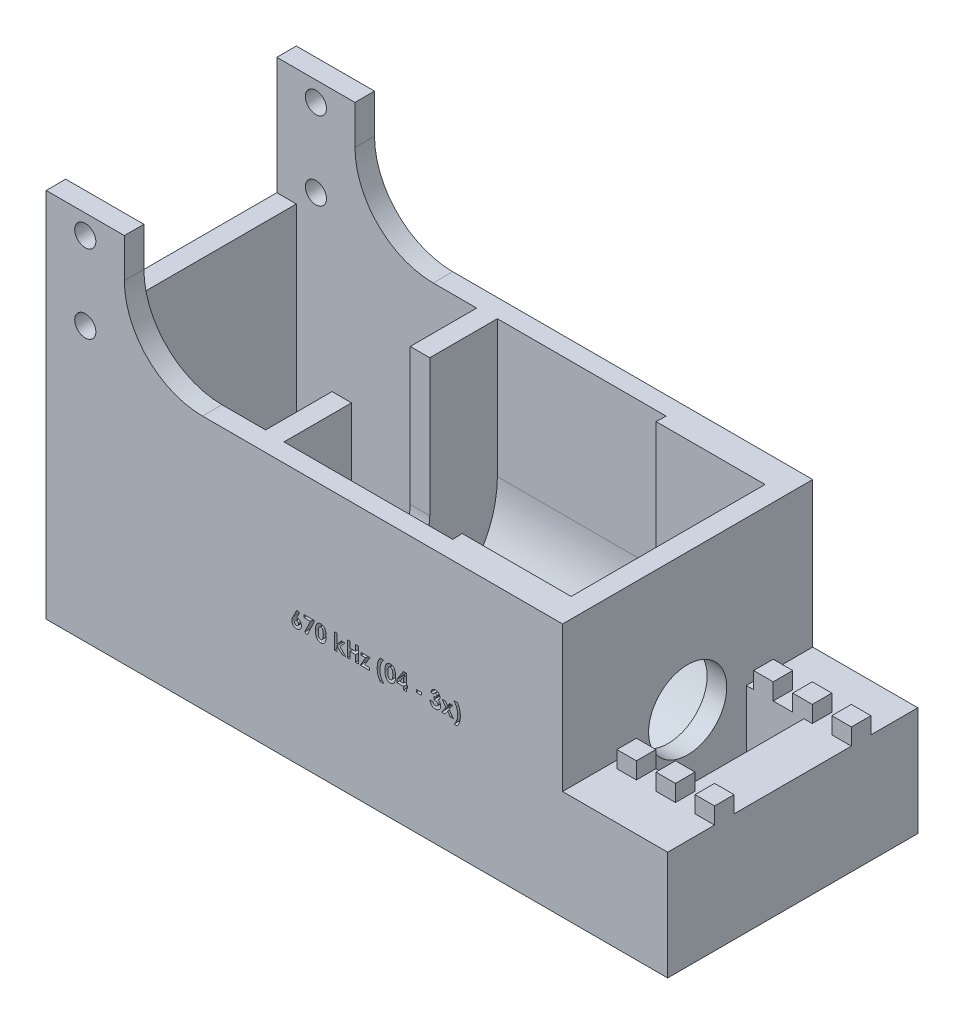
from build123d import *

# Parameters (mm, degrees)
SKETCH1_W                = 157.48
SKETCH1_H                = 76.2
BOSS_EXTRUDE1_DEPTH      = 40.64
SKETCH37_W               = 81.28
SKETCH37_H               = 38.1
CUT_EXTRUDE32_DEPTH      = 180.605122421
BOSS_EXTRUDE5_DEPTH      = 44.45
CUT_EXTRUDE54_DEPTH      = 119.593794104
CUT_EXTRUDE54_DEPTH_BACK = 119.593794104
SKETCH45_W               = 34.146518669
SKETCH45_H               = 47.14875
SKETCH97_W               = 20.4891
SKETCH97_H               = 81.28
CUT_EXTRUDE72_DEPTH      = 76.2
SKETCH99_W               = 27.796518669
SKETCH99_H               = 38.1
CUT_EXTRUDE74_DEPTH      = 123.770316038
SKETCH101_W              = 6.35
SKETCH101_H              = 6.35
BOSS_EXTRUDE7_DEPTH      = 5.3975
BOSS_EXTRUDE8_REACH      = 124.77
SKETCH102_W              = 20.4891
SKETCH102_H              = 6.35
SKETCH104_W              = 1.758461539
SKETCH104_H              = 0.846666666
CUT_EXTRUDE76_DEPTH      = 2.54
BOSS_EXTRUDE9_REACH      = 124.77
SKETCH105_W              = 6.35
SKETCH105_H              = 81.28
CUT_EXTRUDE77_REACH      = 147.407
SKETCH106_R              = 12.7
BOSS_EXTRUDE10_DEPTH     = 38.1
SKETCH108_W              = 81.28
SKETCH108_H              = 82.55
BOSS_EXTRUDE11_DEPTH     = 6.35
SKETCH109_W              = 9.05002
SKETCH109_H              = 38.1
BOSS_EXTRUDE12_DEPTH     = 35.40125
SKETCH110_W              = 25.4
SKETCH110_H              = 38.1
SKETCH110_R              = 3.429
BOSS_EXTRUDE13_DEPTH     = 6.35
FILLET1_R                = 25.4


with BuildPart() as part:
    # Sketch1 → Boss-Extrude1 (new, symmetric)
    with BuildSketch(Plane.XY):
        with Locations((2.54, -38.1)):
            Rectangle(SKETCH1_W, SKETCH1_H)
    extrude(amount=BOSS_EXTRUDE1_DEPTH, both=True)

    # Sketch2 → Cut-Revolve1 (revolve, cut)
    with BuildSketch(Plane.XY, mode=Mode.PRIVATE) as cut_revolve1_sk:
        Polygon((-49.3609, -3.429), (-49.3609, -25.4), (-76.2, -25.4), (-76.2, -38.1), (19.629439755, -38.1), (72.533481331, -38.1), (72.533481331, -28.194), (47.133481331, -28.194), (47.133481331, -6.600833492), (5.361335055, -6.600833492), (5.5031, -3.429), align=None)
    revolve(cut_revolve1_sk.sketch.rotate(Axis((-607.361866059, -38.1, 0), (1, 0, 0)), 90), axis=Axis((-607.361866059, -38.1, 0), (1, 0, 0)), mode=Mode.SUBTRACT)

    # Sketch37 → Cut-Extrude32 (cut, through all)
    with BuildSketch(Plane(origin=(81.28, 0, 0), x_dir=(0, 0, -1), z_dir=(1, 0, 0))):
        with Locations((0, -19.05)):
            Rectangle(SKETCH37_W, SKETCH37_H)
    extrude(amount=-CUT_EXTRUDE32_DEPTH, mode=Mode.SUBTRACT)

    # Sketch39 → Boss-Extrude5 (add)
    with BuildSketch(Plane(origin=(0, -38.1, 0), x_dir=(1, 0, 0), z_dir=(0, 1, 0))):
        Polygon((-49.3609, -12.7), (-76.2, -12.7), (-76.2, -40.64), (81.28, -40.64), (81.28, 40.64), (-76.2, 40.64), (-76.2, 12.7), (-49.3609, 12.7), (-49.3609, 34.671), (5.5031, 34.671), (5.361335055, 31.499166508), (47.133481331, 31.499166508), (47.133481331, 9.906), (72.533481331, 9.906), (72.533481331, -9.906), (47.133481331, -9.906), (47.133481331, -31.499166508), (5.361335055, -31.499166508), (5.5031, -34.671), (-49.3609, -34.671), align=None)
    extrude(amount=BOSS_EXTRUDE5_DEPTH)

    # Sketch45 → Cut-Extrude54 (cut, two sides: drawn at the far end of the back side and taken through both)
    with BuildSketch(Plane.XY.offset(-CUT_EXTRUDE54_DEPTH_BACK)):
        with Locations((64.206740666, -17.224375)):
            Rectangle(SKETCH45_W, SKETCH45_H)
    extrude(amount=CUT_EXTRUDE54_DEPTH + CUT_EXTRUDE54_DEPTH_BACK, mode=Mode.SUBTRACT)

    # Sketch97 → Cut-Extrude72 (cut)
    with BuildSketch(Plane(origin=(0, 6.35, 0), x_dir=(1, 0, 0), z_dir=(0, 1, 0))):
        with Locations((-65.95545, 0)):
            Rectangle(SKETCH97_W, SKETCH97_H)
    extrude(amount=-CUT_EXTRUDE72_DEPTH, mode=Mode.SUBTRACT)

    # Sketch99 → Cut-Extrude74 (cut, through all)
    with BuildSketch(Plane(origin=(0, 6.35, 0), x_dir=(1, 0, 0), z_dir=(0, 1, 0))):
        with Locations((61.031740666, 0)):
            Rectangle(SKETCH99_W, SKETCH99_H)
    extrude(amount=-CUT_EXTRUDE74_DEPTH, mode=Mode.SUBTRACT)

    # Sketch101 → Boss-Extrude7 (add)
    with BuildSketch(Plane(origin=(0, -40.79875, 0), x_dir=(1, 0, 0), z_dir=(0, 1, 0))):
        with Locations((52.705, 22.225)):
            Rectangle(SKETCH101_W, SKETCH101_H)
        with Locations((65.405, 22.225)):
            Rectangle(SKETCH101_W, SKETCH101_H)
        with Locations((78.105, 22.225)):
            Rectangle(SKETCH101_W, SKETCH101_H)
        with Locations((78.105, -22.225)):
            Rectangle(SKETCH101_W, SKETCH101_H)
        with Locations((65.405, -22.225)):
            Rectangle(SKETCH101_W, SKETCH101_H)
        with Locations((52.705, -22.225)):
            Rectangle(SKETCH101_W, SKETCH101_H)
    extrude(amount=BOSS_EXTRUDE7_DEPTH)

    # Sketch102 → Boss-Extrude8 (add, up to next)
    with BuildSketch(Plane(origin=(0, 6.35, 0), x_dir=(1, 0, 0), z_dir=(0, 1, 0)), mode=Mode.PRIVATE) as boss_extrude8_sk1:
        with Locations((-65.95545, 37.465)):
            Rectangle(SKETCH102_W, SKETCH102_H)
    boss_extrude8_tool1 = extrude(boss_extrude8_sk1.sketch, amount=-BOSS_EXTRUDE8_REACH, mode=Mode.PRIVATE) - part.part
    # Sketch102 → Boss-Extrude8 (add, up to next)
    with BuildSketch(Plane(origin=(0, 6.35, 0), x_dir=(1, 0, 0), z_dir=(0, 1, 0)), mode=Mode.PRIVATE) as boss_extrude8_sk2:
        with Locations((-65.95545, -37.465)):
            Rectangle(SKETCH102_W, SKETCH102_H)
    boss_extrude8_tool2 = extrude(boss_extrude8_sk2.sketch, amount=-BOSS_EXTRUDE8_REACH, mode=Mode.PRIVATE) - part.part
    add(boss_extrude8_tool1.solids().sort_by_distance((-65.95545, 6.35, -37.465))[0])
    add(boss_extrude8_tool2.solids().sort_by_distance((-65.95545, 6.35, 37.465))[0])

    # Sketch104 → Cut-Extrude76 (cut)
    # profile 1 of 13: a face of its own
    with BuildSketch(Plane.XY.offset(40.64)):
        with BuildLine():
            Line((-39.172073437, -32.88974359), (-38.36509427, -33.298830128))
            Line((-38.36509427, -33.298830128), (-39.250430809, -35.038974359))
            add(Edge.make_bspline(
                [(-39.250430809, -35.038974359), (-39.198125957, -35.040328558), (-39.095102973, -35.042995875), (-38.943525557, -35.064553577), (-38.798614726, -35.101821675), (-38.65890935, -35.151220437), (-38.526117195, -35.217563466), (-38.398099569, -35.29648196), (-38.278168354, -35.392731551), (-38.163573628, -35.499370993), (-38.059373233, -35.617512167), (-37.968856768, -35.744458613), (-37.889973267, -35.877121706), (-37.828652407, -36.018469442), (-37.77918896, -36.166158823), (-37.743498907, -36.320780225), (-37.723136732, -36.482781398), (-37.720329467, -36.592836133), (-37.71890036, -36.648862179)],
                knots=[0, 0, 0, 0, 1.013260694, 1.995783107, 2.958651975, 3.908806537, 4.861209129, 5.829647963, 6.817170299, 7.835534541, 8.860094905, 9.863329007, 10.853101798, 11.844815043, 12.84250023, 13.867713965, 14.914507806, 16, 16, 16, 16], degree=3))
            add(Edge.make_bspline(
                [(-37.71890036, -36.648862179), (-37.720239551, -36.70286789), (-37.722886559, -36.80961402), (-37.744767577, -36.966396937), (-37.780128452, -37.116820977), (-37.830666244, -37.260585725), (-37.894903864, -37.398393906), (-37.973462122, -37.530164654), (-38.066992507, -37.65491329), (-38.173078451, -37.771976958), (-38.289048689, -37.878681357), (-38.411287637, -37.973526437), (-38.540831132, -38.051872071), (-38.67523065, -38.118036796), (-38.816960568, -38.167410014), (-38.963899892, -38.204678241), (-39.117162904, -38.226183625), (-39.221193911, -38.228887952), (-39.273836258, -38.23025641)],
                knots=[0, 0, 0, 0, 1.049934834, 2.075270938, 3.072134561, 4.05064612, 5.033440221, 6.024524368, 7.028587226, 8.060776465, 9.092543989, 10.090062252, 11.064205434, 12.031961459, 12.998029633, 13.977230324, 14.976426867, 16, 16, 16, 16], degree=3))
            add(Edge.make_bspline(
                [(-39.273836258, -38.23025641), (-39.328884155, -38.229133389), (-39.437128397, -38.22692512), (-39.595516814, -38.202198327), (-39.747424937, -38.164975586), (-39.891999019, -38.111827837), (-40.030138122, -38.04415426), (-40.160215908, -37.960415015), (-40.283328102, -37.861533521), (-40.398162148, -37.749734457), (-40.501619065, -37.627273878), (-40.593893989, -37.500127914), (-40.671958693, -37.368097044), (-40.735150251, -37.231322435), (-40.784453771, -37.090239925), (-40.818758965, -36.944581751), (-40.841111964, -36.794734271), (-40.843732344, -36.693039292), (-40.845054206, -36.641738782)],
                knots=[0, 0, 0, 0, 1.063775006, 2.091769615, 3.092589432, 4.084662827, 5.064601646, 6.061867366, 7.070035304, 8.113879863, 9.156342271, 10.166834137, 11.149076039, 12.117706134, 13.076241869, 14.034148791, 15.008317125, 16, 16, 16, 16], degree=3))
            add(Edge.make_bspline(
                [(-40.845054206, -36.641738782), (-40.84435576, -36.602012538), (-40.84295498, -36.522338918), (-40.828877975, -36.403032002), (-40.807475982, -36.283411916), (-40.782668271, -36.1824727), (-40.757123796, -36.097118029), (-40.731413086, -36.024884678), (-40.699550326, -35.944721452), (-40.663126471, -35.856423648), (-40.620996125, -35.760097487), (-40.573379367, -35.65600553), (-40.520157654, -35.543359513), (-40.482203243, -35.465989143), (-40.462426001, -35.425673077)],
                knots=[0, 0, 0, 0, 1.110454016, 2.227089276, 3.35462975, 4.507227546, 5.131400587, 5.845402449, 6.650387134, 7.543487832, 8.516250726, 9.590168902, 10.744287919, 12, 12, 12, 12], degree=3))
            Line((-40.462426001, -35.425673077), (-39.172073437, -32.88974359))
        make_face()
        with BuildLine():
            add(Edge.make_bspline(
                [(-39.294188822, -35.885641026), (-39.337939515, -35.887647777), (-39.423553878, -35.891574727), (-39.545284699, -35.932699659), (-39.656275589, -35.997214441), (-39.752483865, -36.087063752), (-39.832953235, -36.194437207), (-39.892084952, -36.316910975), (-39.927655966, -36.452850676), (-39.931351566, -36.547897449), (-39.933259334, -36.596963141)],
                knots=[0, 0, 0, 0, 0.981744412, 1.921144944, 2.858899012, 3.85339082, 4.86292663, 5.863643845, 6.897155691, 8, 8, 8, 8], degree=3))
            add(Edge.make_bspline(
                [(-39.933259334, -36.596963141), (-39.931000477, -36.646045172), (-39.926606849, -36.741513003), (-39.889698319, -36.878747093), (-39.829267602, -37.004002097), (-39.744517375, -37.112798484), (-39.645021827, -37.203107908), (-39.534693065, -37.269896045), (-39.415371413, -37.31092619), (-39.332833712, -37.315932412), (-39.291135937, -37.318461538)],
                knots=[0, 0, 0, 0, 1.098279937, 2.136227893, 3.159405121, 4.194678092, 5.206500211, 6.154139736, 7.067477469, 8, 8, 8, 8], degree=3))
            add(Edge.make_bspline(
                [(-39.291135937, -37.318461538), (-39.247098374, -37.315887366), (-39.160733064, -37.310838967), (-39.03614544, -37.271535296), (-38.922333898, -37.205866079), (-38.82170248, -37.115845788), (-38.735262004, -37.008290915), (-38.675453926, -36.88230018), (-38.636839098, -36.744075583), (-38.632789104, -36.647100081), (-38.630695232, -36.596963141)],
                knots=[0, 0, 0, 0, 0.96921794, 1.900804717, 2.848419905, 3.844199796, 4.861108892, 5.867439427, 6.897452859, 8, 8, 8, 8], degree=3))
            add(Edge.make_bspline(
                [(-38.630695232, -36.596963141), (-38.633080535, -36.547926098), (-38.637699953, -36.452960139), (-38.672397253, -36.316383591), (-38.734346941, -36.194381883), (-38.816636996, -36.086620532), (-38.91615625, -35.996811285), (-39.031589221, -35.932190875), (-39.158880909, -35.891647587), (-39.248428585, -35.887672405), (-39.294188822, -35.885641026)],
                knots=[0, 0, 0, 0, 1.083229974, 2.097801324, 3.086792542, 4.086858909, 5.079819718, 6.026392613, 6.991456328, 8, 8, 8, 8], degree=3))
        make_face(mode=Mode.SUBTRACT)
    # profile 2 of 13: a face of its own
    with BuildSketch(Plane.XY.offset(40.64)):
        Polygon((-36.872233693, -33.02), (-33.615823437, -33.02), (-33.615823437, -33.493197115), (-35.856640745, -38.23025641), (-36.66463754, -37.823205128), (-34.792201642, -33.866666667), (-36.872233693, -33.866666667), align=None)
    # profile 3 of 13: a face of its own
    with BuildSketch(Plane.XY.offset(40.64)):
        with BuildLine():
            add(Edge.make_bspline(
                [(-31.449292988, -32.88974359), (-31.405158332, -32.890398781), (-31.318377806, -32.891687063), (-31.190566426, -32.905640199), (-31.06744873, -32.926719497), (-30.948543066, -32.956117767), (-30.834705328, -32.995025331), (-30.725106982, -33.041597017), (-30.621052566, -33.098275607), (-30.521215054, -33.162296986), (-30.425632902, -33.234778263), (-30.336603361, -33.31741066), (-30.252500563, -33.408292804), (-30.175145023, -33.50879867), (-30.102823679, -33.618014049), (-30.035774167, -33.73595626), (-29.974509768, -33.86320255), (-29.918343854, -33.999982547), (-29.868120117, -34.148346524), (-29.825816725, -34.309996278), (-29.789534487, -34.484968726), (-29.758909719, -34.673699402), (-29.735762344, -34.876439172), (-29.720160547, -35.093053346), (-29.709453856, -35.323124326), (-29.70858005, -35.480951127), (-29.708131129, -35.562035256)],
                knots=[0, 0, 0, 0, 0.879237366, 1.728815576, 2.559023295, 3.367336655, 4.166867292, 4.954216142, 5.737608147, 6.525189134, 7.316157332, 8.124696809, 8.942788509, 9.781158001, 10.649253743, 11.551476218, 12.482711956, 13.461909668, 14.496590415, 15.601789533, 16.789733467, 18.056700938, 19.410929216, 20.8549011, 22.384193279, 24, 24, 24, 24], degree=3))
            add(Edge.make_bspline(
                [(-29.708131129, -35.562035256), (-29.708616292, -35.64413384), (-29.709558953, -35.803649914), (-29.719715467, -36.035825239), (-29.737205464, -36.254012163), (-29.759747833, -36.458188112), (-29.790624714, -36.648245265), (-29.826785833, -36.824675741), (-29.869756972, -36.987415589), (-29.921635063, -37.136098122), (-29.977461003, -37.273118334), (-30.038892987, -37.400116525), (-30.104860262, -37.517436676), (-30.17384974, -37.626848721), (-30.249643675, -37.725127247), (-30.328552965, -37.81561424), (-30.414013461, -37.894862933), (-30.502426944, -37.966957449), (-30.59703236, -38.029261578), (-30.696854066, -38.083751742), (-30.803671711, -38.127949738), (-30.91553819, -38.166390793), (-31.034360292, -38.193987323), (-31.158249947, -38.215884263), (-31.288605847, -38.227985855), (-31.377357394, -38.229487137), (-31.422834655, -38.23025641)],
                knots=[0, 0, 0, 0, 1.643780988, 3.193836972, 4.651895693, 6.025988579, 7.305620092, 8.505800249, 9.631074763, 10.672816429, 11.65661981, 12.592235626, 13.49536222, 14.350718032, 15.179365177, 15.97804903, 16.751647189, 17.51006938, 18.259804725, 19.016521909, 19.783502495, 20.571750527, 21.382245291, 22.22305063, 23.089471752, 24, 24, 24, 24], degree=3))
            add(Edge.make_bspline(
                [(-31.422834655, -38.23025641), (-31.468310689, -38.229472298), (-31.55739757, -38.227936234), (-31.688105965, -38.215974243), (-31.812652173, -38.193898618), (-31.932414348, -38.166178927), (-32.046558963, -38.128034792), (-32.155633339, -38.082514425), (-32.258798787, -38.028364252), (-32.356340957, -37.96591496), (-32.447926812, -37.894302811), (-32.534979596, -37.814293778), (-32.617306742, -37.726090663), (-32.693655851, -37.628705518), (-32.7652773, -37.523438232), (-32.831424191, -37.409086703), (-32.892056771, -37.285817425), (-32.949071639, -37.153458573), (-32.998610342, -37.009160612), (-33.042697488, -36.851634981), (-33.078812518, -36.679568573), (-33.107858641, -36.493016666), (-33.13104905, -36.292374478), (-33.148300048, -36.077545166), (-33.158512977, -35.848428667), (-33.159445753, -35.690945484), (-33.159926001, -35.609863782)],
                knots=[0, 0, 0, 0, 0.917216111, 1.796812873, 2.643793957, 3.46689424, 4.273913431, 5.068098542, 5.848489301, 6.620921603, 7.401012384, 8.190319798, 9.003608147, 9.831726257, 10.68377682, 11.569763213, 12.493818149, 13.453288342, 14.474581811, 15.568529029, 16.750744269, 18.018426408, 19.375425659, 20.823733699, 22.36466933, 24, 24, 24, 24], degree=3))
            add(Edge.make_bspline(
                [(-33.159926001, -35.609863782), (-33.159056076, -35.49720714), (-33.157377544, -35.279834698), (-33.136105958, -34.965794719), (-33.104884665, -34.675519159), (-33.059027981, -34.409493576), (-33.002326825, -34.16673269), (-32.929718043, -33.948835682), (-32.847058226, -33.752787457), (-32.776621442, -33.636647309), (-32.742698437, -33.580713141)],
                knots=[0, 0, 0, 0, 1.288568992, 2.486310467, 3.599230591, 4.627010532, 5.572937695, 6.447898582, 7.252493626, 8, 8, 8, 8], degree=3))
            add(Edge.make_bspline(
                [(-32.742698437, -33.580713141), (-32.703254382, -33.525763432), (-32.626133483, -33.418325923), (-32.491285435, -33.277280557), (-32.346408764, -33.156651653), (-32.188527786, -33.059169151), (-32.020139455, -32.982294442), (-31.839798071, -32.927998702), (-31.648169605, -32.896363473), (-31.516575141, -32.891983169), (-31.449292988, -32.88974359)],
                knots=[0, 0, 0, 0, 1.058512271, 2.069600068, 3.047294572, 4.004278952, 4.967380941, 5.939006123, 6.946246673, 8, 8, 8, 8], degree=3))
        make_face()
        with BuildLine():
            add(Edge.make_bspline(
                [(-31.426905168, -33.801538462), (-31.466803263, -33.803429552), (-31.545024709, -33.807137093), (-31.658527753, -33.838608885), (-31.765554038, -33.887218766), (-31.846966074, -33.945713156), (-31.907902173, -34.001787044), (-31.950478663, -34.05253209), (-31.991536976, -34.109159903), (-32.027801746, -34.174225806), (-32.062045156, -34.245391905), (-32.095511289, -34.32298125), (-32.12294473, -34.408899604), (-32.149897359, -34.501683767), (-32.173510376, -34.603898973), (-32.193292908, -34.71638072), (-32.210966862, -34.839860486), (-32.223294655, -34.974419151), (-32.234787858, -35.119915934), (-32.243026731, -35.276674944), (-32.246471196, -35.444653892), (-32.247566087, -35.560338501), (-32.248131129, -35.620040064)],
                knots=[0, 0, 0, 0, 1.076674018, 2.110852608, 3.161083442, 4.239746716, 4.804137807, 5.395870207, 6.026861976, 6.692161227, 7.405688833, 8.16177676, 8.973626916, 9.841385931, 10.773283133, 11.807421078, 12.927755683, 14.143907515, 15.458935494, 16.872852025, 18.386167141, 20, 20, 20, 20], degree=3))
            add(Edge.make_bspline(
                [(-32.248131129, -35.620040064), (-32.247201138, -35.697386325), (-32.245417812, -35.845703516), (-32.23607758, -36.058988801), (-32.21735586, -36.253095584), (-32.194069821, -36.4293394), (-32.161363628, -36.586577259), (-32.123733035, -36.726296778), (-32.0772626, -36.846716872), (-32.023557058, -36.949579087), (-31.96407575, -37.03708376), (-31.899506174, -37.111463125), (-31.832046692, -37.175872147), (-31.759591674, -37.228190802), (-31.682313977, -37.268285407), (-31.600858728, -37.297124961), (-31.515174161, -37.314778853), (-31.456498254, -37.31722688), (-31.426905168, -37.318461538)],
                knots=[0, 0, 0, 0, 1.771748488, 3.397459088, 4.888034009, 6.237357457, 7.467047327, 8.564189669, 9.548206622, 10.417051504, 11.216568818, 11.965764335, 12.669334354, 13.348544111, 14.005342236, 14.656555988, 15.322436492, 16, 16, 16, 16], degree=3))
            add(Edge.make_bspline(
                [(-31.426905168, -37.318461538), (-31.398327623, -37.317616694), (-31.342376343, -37.315962593), (-31.260786847, -37.298983468), (-31.183630022, -37.271379099), (-31.111138829, -37.232330782), (-31.043053976, -37.182674872), (-30.979708221, -37.122193159), (-30.921579304, -37.050282783), (-30.887713134, -36.996914649), (-30.87026254, -36.969415064)],
                knots=[0, 0, 0, 0, 0.992283464, 1.942767638, 2.88273346, 3.832339453, 4.79467288, 5.803907806, 6.868395428, 8, 8, 8, 8], degree=3))
            add(Edge.make_bspline(
                [(-30.87026254, -36.969415064), (-30.849717404, -36.93183776), (-30.806635921, -36.8530412), (-30.756781954, -36.720074943), (-30.714817663, -36.570110982), (-30.678699612, -36.402682614), (-30.653997068, -36.217129481), (-30.632723268, -36.014628192), (-30.622462385, -35.794159032), (-30.620793396, -35.641417203), (-30.619926001, -35.562035256)],
                knots=[0, 0, 0, 0, 0.710965849, 1.490837728, 2.352621235, 3.297892224, 4.334225155, 5.461620853, 6.680770821, 8, 8, 8, 8], degree=3))
            add(Edge.make_bspline(
                [(-30.619926001, -35.562035256), (-30.620261057, -35.481964236), (-30.620905983, -35.327841191), (-30.632738503, -35.106579429), (-30.649216192, -34.904493531), (-30.673318293, -34.722034673), (-30.704330028, -34.558759924), (-30.742552107, -34.414679958), (-30.787613096, -34.289510821), (-30.841050058, -34.183377324), (-30.900234814, -34.093178411), (-30.96306124, -34.01579474), (-31.02979499, -33.949726514), (-31.100324464, -33.894725106), (-31.176282093, -33.852699906), (-31.256216985, -33.823026638), (-31.340293014, -33.805075306), (-31.397644768, -33.802733322), (-31.426905168, -33.801538462)],
                knots=[0, 0, 0, 0, 1.793836731, 3.452829483, 4.963243077, 6.335886805, 7.574563692, 8.684454726, 9.672768357, 10.54971625, 11.340229787, 12.085688095, 12.778991901, 13.440269426, 14.083255152, 14.715733572, 15.344777694, 16, 16, 16, 16], degree=3))
        make_face(mode=Mode.SUBTRACT)
    # profile 4 of 13: a face of its own
    with BuildSketch(Plane.XY.offset(40.64)):
        Polygon((-27.037874719, -32.88974359), (-26.126079847, -32.88974359), (-26.126079847, -35.92838141), (-24.707506129, -34.387692308), (-23.580991706, -34.387692308), (-25.210214463, -36.157347756), (-23.347954847, -38.1), (-24.495839463, -38.1), (-26.126079847, -36.399543269), (-26.126079847, -38.1), (-27.037874719, -38.1), align=None)
    # profile 5 of 13: a face of its own
    with BuildSketch(Plane.XY.offset(40.64)):
        Polygon((-22.804541386, -33.02), (-21.892746514, -33.02), (-21.892746514, -34.973846154), (-20.134284975, -34.973846154), (-20.134284975, -33.02), (-19.222490104, -33.02), (-19.222490104, -38.1), (-20.134284975, -38.1), (-20.134284975, -35.885641026), (-21.892746514, -35.885641026), (-21.892746514, -38.1), (-22.804541386, -38.1), align=None)
    # profile 6 of 13: a face of its own
    with BuildSketch(Plane.XY.offset(40.64)):
        Polygon((-18.310695232, -34.387692308), (-15.445054206, -34.387692308), (-17.152634334, -37.318461538), (-15.575310616, -37.318461538), (-15.575310616, -38.1), (-18.571208052, -38.1), (-16.863627924, -35.169230769), (-18.310695232, -35.169230769), align=None)
    # profile 7 of 13: a face of its own
    with BuildSketch(Plane.XY.offset(40.64)):
        with BuildLine():
            Line((-12.155062219, -32.88974359), (-11.016336258, -32.88974359))
            add(Edge.make_bspline(
                [(-11.016336258, -32.88974359), (-11.064763976, -32.945901653), (-11.16092096, -33.057407833), (-11.293606764, -33.232148184), (-11.418396295, -33.409331897), (-11.533505033, -33.590688771), (-11.639150224, -33.775907622), (-11.73620406, -33.964068959), (-11.822793818, -34.156116037), (-11.900430083, -34.351979385), (-11.968966932, -34.553295504), (-12.027931989, -34.761191002), (-12.077607759, -34.97586635), (-12.118457008, -35.197578165), (-12.149833266, -35.426126606), (-12.171707103, -35.662116454), (-12.186928062, -35.904776108), (-12.188067578, -36.069129226), (-12.18864395, -36.152259615)],
                knots=[0, 0, 0, 0, 1.00236213, 1.990267575, 2.964862165, 3.931797803, 4.893137898, 5.846900052, 6.793123604, 7.740135921, 8.694427184, 9.667077551, 10.660503013, 11.672460941, 12.714089686, 13.778281025, 14.87624668, 16, 16, 16, 16], degree=3))
            add(Edge.make_bspline(
                [(-12.18864395, -36.152259615), (-12.187686258, -36.242170849), (-12.18579837, -36.419411868), (-12.170275765, -36.681187515), (-12.144601459, -36.934703768), (-12.110880266, -37.180444682), (-12.064522703, -37.417268598), (-12.009948628, -37.646424364), (-11.944211717, -37.86689538), (-11.891883373, -38.009340947), (-11.866055809, -38.079647436)],
                knots=[0, 0, 0, 0, 1.097990858, 2.164457195, 3.201156713, 4.209415668, 5.192484095, 6.147015238, 7.085427113, 8, 8, 8, 8], degree=3))
            add(Edge.make_bspline(
                [(-11.866055809, -38.079647436), (-11.843904352, -38.13383593), (-11.798669361, -38.244493031), (-11.718202878, -38.409424987), (-11.628133908, -38.577938975), (-11.526076126, -38.749277676), (-11.41633677, -38.925658505), (-11.291859447, -39.103205095), (-11.159222316, -39.285607619), (-11.06455224, -39.406248999), (-11.016336258, -39.467692308)],
                knots=[0, 0, 0, 0, 0.860028042, 1.756243877, 2.695094802, 3.667075869, 4.686284936, 5.746781471, 6.852423585, 8, 8, 8, 8], degree=3))
            Line((-11.016336258, -39.467692308), (-12.155062219, -39.467692308))
            add(Edge.make_bspline(
                [(-12.155062219, -39.467692308), (-12.197990499, -39.397443944), (-12.282258774, -39.259546303), (-12.397725175, -39.050622607), (-12.506339563, -38.847227061), (-12.602662152, -38.645778288), (-12.691202392, -38.448929197), (-12.766422771, -38.253914829), (-12.835976509, -38.063976685), (-12.893266715, -37.874218158), (-12.942207734, -37.68226533), (-12.985506698, -37.484182202), (-13.020413358, -37.277603308), (-13.050296301, -37.062851037), (-13.07220815, -36.839772414), (-13.088338209, -36.608681843), (-13.099031059, -36.369454361), (-13.099964489, -36.20722322), (-13.100438822, -36.124783654)],
                knots=[0, 0, 0, 0, 1.119871376, 2.19830916, 3.246961562, 4.256259542, 5.235550337, 6.182491613, 7.09917337, 7.986748165, 8.877687696, 9.793695483, 10.744317876, 11.727190303, 12.742913882, 13.793068013, 14.878522868, 16, 16, 16, 16], degree=3))
            add(Edge.make_bspline(
                [(-13.100438822, -36.124783654), (-13.100051619, -36.044036694), (-13.099288207, -35.88483511), (-13.087305396, -35.650022563), (-13.070069912, -35.422680048), (-13.047559151, -35.202878624), (-13.015220688, -34.9909313), (-12.978254585, -34.786395131), (-12.933289716, -34.589498086), (-12.881138625, -34.398638217), (-12.820419663, -34.211432073), (-12.752181999, -34.024601806), (-12.674703115, -33.837229878), (-12.587861219, -33.649140064), (-12.493287696, -33.459524186), (-12.38953926, -33.269374824), (-12.276326602, -33.078939225), (-12.195790875, -32.953288085), (-12.155062219, -32.88974359)],
                knots=[0, 0, 0, 0, 1.13127193, 2.230428031, 3.293392423, 4.325815098, 5.325330466, 6.296707414, 7.23754678, 8.15420938, 9.068070667, 9.994306547, 10.940496973, 11.908145907, 12.896524899, 13.908929949, 14.942500703, 16, 16, 16, 16], degree=3))
        make_face()
    # profile 8 of 13: a face of its own
    with BuildSketch(Plane.XY.offset(40.64)):
        with BuildLine():
            add(Edge.make_bspline(
                [(-8.849805809, -32.88974359), (-8.805671153, -32.890398781), (-8.718890627, -32.891687063), (-8.591079247, -32.905640199), (-8.467961551, -32.926719497), (-8.349055886, -32.956117767), (-8.235218148, -32.995025331), (-8.125619803, -33.041597017), (-8.021565387, -33.098275607), (-7.921727874, -33.162296986), (-7.826145722, -33.234778263), (-7.737116181, -33.31741066), (-7.653013383, -33.408292804), (-7.575657843, -33.50879867), (-7.503336499, -33.618014049), (-7.436286988, -33.73595626), (-7.375022589, -33.86320255), (-7.318856675, -33.999982547), (-7.268632937, -34.148346524), (-7.226329545, -34.309996278), (-7.190047308, -34.484968726), (-7.15942254, -34.673699402), (-7.136275164, -34.876439172), (-7.120673368, -35.093053346), (-7.109966676, -35.323124326), (-7.109092871, -35.480951127), (-7.10864395, -35.562035256)],
                knots=[0, 0, 0, 0, 0.879237366, 1.728815576, 2.559023295, 3.367336655, 4.166867292, 4.954216142, 5.737608147, 6.525189134, 7.316157332, 8.124696809, 8.942788509, 9.781158001, 10.649253743, 11.551476218, 12.482711956, 13.461909668, 14.496590415, 15.601789533, 16.789733467, 18.056700938, 19.410929216, 20.8549011, 22.384193279, 24, 24, 24, 24], degree=3))
            add(Edge.make_bspline(
                [(-7.10864395, -35.562035256), (-7.109129112, -35.64413384), (-7.110071774, -35.803649914), (-7.120228287, -36.035825239), (-7.137718284, -36.254012163), (-7.160260654, -36.458188112), (-7.191137535, -36.648245265), (-7.227298654, -36.824675741), (-7.270269792, -36.987415589), (-7.322147884, -37.136098122), (-7.377973824, -37.273118334), (-7.439405807, -37.400116525), (-7.505373083, -37.517436676), (-7.57436256, -37.626848721), (-7.650156496, -37.725127247), (-7.729065786, -37.81561424), (-7.814526281, -37.894862933), (-7.902939765, -37.966957449), (-7.99754518, -38.029261578), (-8.097366886, -38.083751742), (-8.204184531, -38.127949738), (-8.316051011, -38.166390793), (-8.434873112, -38.193987323), (-8.558762768, -38.215884263), (-8.689118667, -38.227985855), (-8.777870214, -38.229487137), (-8.823347475, -38.23025641)],
                knots=[0, 0, 0, 0, 1.643780988, 3.193836972, 4.651895693, 6.025988579, 7.305620092, 8.505800249, 9.631074763, 10.672816429, 11.65661981, 12.592235626, 13.49536222, 14.350718032, 15.179365177, 15.97804903, 16.751647189, 17.51006938, 18.259804725, 19.016521909, 19.783502495, 20.571750527, 21.382245291, 22.22305063, 23.089471752, 24, 24, 24, 24], degree=3))
            add(Edge.make_bspline(
                [(-8.823347475, -38.23025641), (-8.868823509, -38.229472298), (-8.95791039, -38.227936234), (-9.088618785, -38.215974243), (-9.213164994, -38.193898618), (-9.332927169, -38.166178927), (-9.447071784, -38.128034792), (-9.556146159, -38.082514425), (-9.659311608, -38.028364252), (-9.756853778, -37.96591496), (-9.848439633, -37.894302811), (-9.935492416, -37.814293778), (-10.017819563, -37.726090663), (-10.094168672, -37.628705518), (-10.165790121, -37.523438232), (-10.231937012, -37.409086703), (-10.292569592, -37.285817425), (-10.34958446, -37.153458573), (-10.399123163, -37.009160612), (-10.443210308, -36.851634981), (-10.479325338, -36.679568573), (-10.508371462, -36.493016666), (-10.53156187, -36.292374478), (-10.548812869, -36.077545166), (-10.559025797, -35.848428667), (-10.559958573, -35.690945484), (-10.560438822, -35.609863782)],
                knots=[0, 0, 0, 0, 0.917216111, 1.796812873, 2.643793957, 3.46689424, 4.273913431, 5.068098542, 5.848489301, 6.620921603, 7.401012384, 8.190319798, 9.003608147, 9.831726257, 10.68377682, 11.569763213, 12.493818149, 13.453288342, 14.474581811, 15.568529029, 16.750744269, 18.018426408, 19.375425659, 20.823733699, 22.36466933, 24, 24, 24, 24], degree=3))
            add(Edge.make_bspline(
                [(-10.560438822, -35.609863782), (-10.559568897, -35.49720714), (-10.557890365, -35.279834698), (-10.536618779, -34.965794719), (-10.505397485, -34.675519159), (-10.459540801, -34.409493576), (-10.402839646, -34.16673269), (-10.330230863, -33.948835682), (-10.247571046, -33.752787457), (-10.177134263, -33.636647309), (-10.143211258, -33.580713141)],
                knots=[0, 0, 0, 0, 1.288568992, 2.486310467, 3.599230591, 4.627010532, 5.572937695, 6.447898582, 7.252493626, 8, 8, 8, 8], degree=3))
            add(Edge.make_bspline(
                [(-10.143211258, -33.580713141), (-10.103767203, -33.525763432), (-10.026646303, -33.418325923), (-9.891798255, -33.277280557), (-9.746921585, -33.156651653), (-9.589040607, -33.059169151), (-9.420652276, -32.982294442), (-9.240310892, -32.927998702), (-9.048682426, -32.896363473), (-8.917087961, -32.891983169), (-8.849805809, -32.88974359)],
                knots=[0, 0, 0, 0, 1.058512271, 2.069600068, 3.047294572, 4.004278952, 4.967380941, 5.939006123, 6.946246673, 8, 8, 8, 8], degree=3))
        make_face()
        with BuildLine():
            add(Edge.make_bspline(
                [(-8.827417988, -33.801538462), (-8.867316083, -33.803429552), (-8.945537529, -33.807137093), (-9.059040574, -33.838608885), (-9.166066858, -33.887218766), (-9.247478894, -33.945713156), (-9.308414994, -34.001787044), (-9.350991483, -34.05253209), (-9.392049797, -34.109159903), (-9.428314567, -34.174225806), (-9.462557976, -34.245391905), (-9.496024109, -34.32298125), (-9.523457551, -34.408899604), (-9.550410179, -34.501683767), (-9.574023197, -34.603898973), (-9.593805729, -34.71638072), (-9.611479683, -34.839860486), (-9.623807476, -34.974419151), (-9.635300679, -35.119915934), (-9.643539551, -35.276674944), (-9.646984017, -35.444653892), (-9.648078908, -35.560338501), (-9.64864395, -35.620040064)],
                knots=[0, 0, 0, 0, 1.076674018, 2.110852608, 3.161083442, 4.239746716, 4.804137807, 5.395870207, 6.026861976, 6.692161227, 7.405688833, 8.16177676, 8.973626916, 9.841385931, 10.773283133, 11.807421078, 12.927755683, 14.143907515, 15.458935494, 16.872852025, 18.386167141, 20, 20, 20, 20], degree=3))
            add(Edge.make_bspline(
                [(-9.64864395, -35.620040064), (-9.647713959, -35.697386325), (-9.645930632, -35.845703516), (-9.6365904, -36.058988801), (-9.617868681, -36.253095584), (-9.594582641, -36.4293394), (-9.561876448, -36.586577259), (-9.524245856, -36.726296778), (-9.477775421, -36.846716872), (-9.424069878, -36.949579087), (-9.36458857, -37.03708376), (-9.300018994, -37.111463125), (-9.232559512, -37.175872147), (-9.160104495, -37.228190802), (-9.082826798, -37.268285407), (-9.001371548, -37.297124961), (-8.915686982, -37.314778853), (-8.857011074, -37.31722688), (-8.827417988, -37.318461538)],
                knots=[0, 0, 0, 0, 1.771748488, 3.397459088, 4.888034009, 6.237357457, 7.467047327, 8.564189669, 9.548206622, 10.417051504, 11.216568818, 11.965764335, 12.669334354, 13.348544111, 14.005342236, 14.656555988, 15.322436492, 16, 16, 16, 16], degree=3))
            add(Edge.make_bspline(
                [(-8.827417988, -37.318461538), (-8.798840443, -37.317616694), (-8.742889164, -37.315962593), (-8.661299668, -37.298983468), (-8.584142843, -37.271379099), (-8.511651649, -37.232330782), (-8.443566797, -37.182674872), (-8.380221042, -37.122193159), (-8.322092125, -37.050282783), (-8.288225954, -36.996914649), (-8.27077536, -36.969415064)],
                knots=[0, 0, 0, 0, 0.992283464, 1.942767638, 2.88273346, 3.832339453, 4.79467288, 5.803907806, 6.868395428, 8, 8, 8, 8], degree=3))
            add(Edge.make_bspline(
                [(-8.27077536, -36.969415064), (-8.250230224, -36.93183776), (-8.207148741, -36.8530412), (-8.157294774, -36.720074943), (-8.115330484, -36.570110982), (-8.079212433, -36.402682614), (-8.054509889, -36.217129481), (-8.033236088, -36.014628192), (-8.022975205, -35.794159032), (-8.021306217, -35.641417203), (-8.020438822, -35.562035256)],
                knots=[0, 0, 0, 0, 0.710965849, 1.490837728, 2.352621235, 3.297892224, 4.334225155, 5.461620853, 6.680770821, 8, 8, 8, 8], degree=3))
            add(Edge.make_bspline(
                [(-8.020438822, -35.562035256), (-8.020773878, -35.481964236), (-8.021418803, -35.327841191), (-8.033251324, -35.106579429), (-8.049729012, -34.904493531), (-8.073831114, -34.722034673), (-8.104842848, -34.558759924), (-8.143064928, -34.414679958), (-8.188125916, -34.289510821), (-8.241562879, -34.183377324), (-8.300747635, -34.093178411), (-8.36357406, -34.01579474), (-8.43030781, -33.949726514), (-8.500837285, -33.894725106), (-8.576794913, -33.852699906), (-8.656729805, -33.823026638), (-8.740805834, -33.805075306), (-8.798157589, -33.802733322), (-8.827417988, -33.801538462)],
                knots=[0, 0, 0, 0, 1.793836731, 3.452829483, 4.963243077, 6.335886805, 7.574563692, 8.684454726, 9.672768357, 10.54971625, 11.340229787, 12.085688095, 12.778991901, 13.440269426, 14.083255152, 14.715733572, 15.344777694, 16, 16, 16, 16], degree=3))
        make_face(mode=Mode.SUBTRACT)
    # profile 9 of 13: a face of its own
    with BuildSketch(Plane.XY.offset(40.64)):
        Polygon((-4.607313822, -32.88974359), (-3.656849078, -32.88974359), (-3.656849078, -36.211282051), (-3.200951642, -36.211282051), (-3.200951642, -37.057948718), (-3.656849078, -37.057948718), (-3.656849078, -38.1), (-4.56864395, -38.1), (-4.56864395, -37.057948718), (-6.717874719, -37.057948718), (-6.717874719, -36.134959936), align=None)
        Polygon((-4.56864395, -36.211282051), (-4.56864395, -34.482331731), (-5.693123116, -36.211282051), align=None, mode=Mode.SUBTRACT)
    # profile 10 of 13: a face of its own
    with BuildSketch(Plane.XY.offset(40.64)):
        with Locations((0.478791948, -36.243846154)):
            Rectangle(SKETCH104_W, SKETCH104_H)
    # profile 11 of 13: a face of its own
    with BuildSketch(Plane.XY.offset(40.64)):
        with BuildLine():
            Line((5.265715025, -34.257435897), (4.353920153, -34.257435897))
            add(Edge.make_bspline(
                [(4.353920153, -34.257435897), (4.360357771, -34.211858525), (4.372978296, -34.122507104), (4.403177524, -33.993148506), (4.439299059, -33.870443023), (4.484394951, -33.754779238), (4.537285095, -33.645951115), (4.597431658, -33.54358521), (4.665484847, -33.448120896), (4.717648338, -33.390612814), (4.743671755, -33.361923077)],
                knots=[0, 0, 0, 0, 1.111473889, 2.178970933, 3.205615836, 4.199322666, 5.174200091, 6.12565194, 7.064921805, 8, 8, 8, 8], degree=3))
            add(Edge.make_bspline(
                [(4.743671755, -33.361923077), (4.781207087, -33.324069048), (4.855185281, -33.249462734), (4.97881152, -33.153900287), (5.108394649, -33.071197489), (5.246533515, -33.005630112), (5.391078572, -32.952560916), (5.543179294, -32.916914217), (5.702214142, -32.893262318), (5.810735419, -32.890932523), (5.866115666, -32.88974359)],
                knots=[0, 0, 0, 0, 1.01925491, 2.00884431, 2.983262333, 3.955970413, 4.92937149, 5.924503185, 6.940838805, 8, 8, 8, 8], degree=3))
            add(Edge.make_bspline(
                [(5.866115666, -32.88974359), (5.915351554, -32.890905953), (6.01213939, -32.893190924), (6.154393155, -32.911533432), (6.290020215, -32.943704149), (6.420454188, -32.98576664), (6.543776815, -33.042999688), (6.662709946, -33.109435076), (6.773930585, -33.19092084), (6.877698967, -33.282991552), (6.973030018, -33.382575041), (7.055587125, -33.4890216), (7.126562952, -33.599487798), (7.185037645, -33.714891399), (7.229996738, -33.835427681), (7.261199681, -33.96040032), (7.281622766, -34.089533556), (7.283657439, -34.177303678), (7.284689384, -34.22181891)],
                knots=[0, 0, 0, 0, 1.091422571, 2.145516843, 3.172569842, 4.178562979, 5.178154469, 6.181868002, 7.194278174, 8.227918432, 9.254613415, 10.245994977, 11.209837596, 12.161663635, 13.10878368, 14.055455738, 15.013766427, 16, 16, 16, 16], degree=3))
            add(Edge.make_bspline(
                [(7.284689384, -34.22181891), (7.282571771, -34.276947319), (7.278402842, -34.385478207), (7.244193766, -34.544321225), (7.19064726, -34.696203497), (7.113294123, -34.838999962), (7.016583, -34.972322007), (6.897921692, -35.091712277), (6.760689979, -35.199042649), (6.657668305, -35.256722003), (6.604913742, -35.286258013)],
                knots=[0, 0, 0, 0, 0.992805628, 1.954529043, 2.915727527, 3.886831945, 4.871318353, 5.87440735, 6.911542536, 8, 8, 8, 8], degree=3))
            add(Edge.make_bspline(
                [(6.604913742, -35.286258013), (6.641123665, -35.298146493), (6.712274539, -35.321506823), (6.81340695, -35.367514728), (6.909572317, -35.417793743), (6.999114707, -35.476204703), (7.082924727, -35.54038573), (7.160491461, -35.610885466), (7.232278353, -35.687550188), (7.297113509, -35.770801523), (7.354657244, -35.859308028), (7.406288173, -35.951025256), (7.448783306, -36.047344114), (7.484781974, -36.147164576), (7.51218931, -36.251383777), (7.531486524, -36.359597875), (7.542640787, -36.471560026), (7.544342003, -36.547414316), (7.545202204, -36.585769231)],
                knots=[0, 0, 0, 0, 1.059543567, 2.081955587, 3.086750234, 4.076226789, 5.052108497, 6.020845489, 6.989030705, 7.970690546, 8.952259656, 9.923888338, 10.895517021, 11.877585046, 12.873342345, 13.889638361, 14.932918083, 16, 16, 16, 16], degree=3))
            add(Edge.make_bspline(
                [(7.545202204, -36.585769231), (7.54345846, -36.642135383), (7.540020152, -36.753277956), (7.518161, -36.916979591), (7.477463196, -37.073054557), (7.423922982, -37.22329873), (7.352506146, -37.365772513), (7.268460537, -37.503745486), (7.165151596, -37.632432783), (7.050341448, -37.755236563), (6.922838085, -37.866884261), (6.784603697, -37.963677791), (6.638677939, -38.046743862), (6.484137581, -38.114179264), (6.321036313, -38.166112237), (6.149737674, -38.203651784), (5.969521914, -38.226619099), (5.846510558, -38.229026787), (5.783687781, -38.23025641)],
                knots=[0, 0, 0, 0, 1.005138573, 1.981928558, 2.936866704, 3.876260664, 4.820238198, 5.773547, 6.751179199, 7.756627054, 8.768222608, 9.766606018, 10.760583154, 11.757261445, 12.767156078, 13.807575856, 14.880313354, 16, 16, 16, 16], degree=3))
            add(Edge.make_bspline(
                [(5.783687781, -38.23025641), (5.724258447, -38.22895998), (5.608052249, -38.226424984), (5.438076364, -38.204483301), (5.276530374, -38.169089586), (5.123002012, -38.119199209), (4.978085266, -38.054499917), (4.840465976, -37.977457577), (4.712890303, -37.883628567), (4.593936804, -37.777248504), (4.486244226, -37.657896114), (4.389992423, -37.528336136), (4.307303762, -37.388075905), (4.237839138, -37.237714672), (4.182141607, -37.076988659), (4.138207557, -36.90622471), (4.107518905, -36.725089204), (4.098172611, -36.600464123), (4.093407332, -36.536923077)],
                knots=[0, 0, 0, 0, 1.066544725, 2.085487077, 3.070979577, 4.031932826, 4.977951092, 5.916076795, 6.857635327, 7.814973522, 8.776389752, 9.738577119, 10.707772778, 11.69409279, 12.707140348, 13.757286496, 14.856535458, 16, 16, 16, 16], degree=3))
            Line((4.093407332, -36.536923077), (5.005202204, -36.536923077))
            add(Edge.make_bspline(
                [(5.005202204, -36.536923077), (5.010980153, -36.568872349), (5.022234224, -36.631101935), (5.044184599, -36.721196541), (5.072789001, -36.804359427), (5.105862805, -36.881329743), (5.141587494, -36.953118081), (5.18475146, -37.017073121), (5.232191876, -37.074931505), (5.300648742, -37.14371419), (5.398512547, -37.214385527), (5.530661106, -37.275802281), (5.677663863, -37.311800044), (5.780433451, -37.316191661), (5.833551563, -37.318461538)],
                knots=[0, 0, 0, 0, 0.928156231, 1.807827665, 2.648129825, 3.438902246, 4.202261636, 4.936546065, 5.639352463, 6.338805438, 7.70633318, 9.064371875, 10.482673459, 12, 12, 12, 12], degree=3))
            add(Edge.make_bspline(
                [(5.833551563, -37.318461538), (5.861737911, -37.317978189), (5.91694866, -37.317031417), (5.99804503, -37.30653771), (6.075300741, -37.289254566), (6.148859686, -37.265767415), (6.219190145, -37.236324802), (6.284948385, -37.198360315), (6.347474722, -37.154221179), (6.406089439, -37.104597072), (6.460250646, -37.05052456), (6.505315955, -36.990648439), (6.546502387, -36.929803599), (6.576964168, -36.864009355), (6.603655252, -36.796806141), (6.619991558, -36.72575469), (6.632326642, -36.652345471), (6.633043508, -36.602107424), (6.633407332, -36.576610577)],
                knots=[0, 0, 0, 0, 1.110435564, 2.175094844, 3.216326037, 4.226890168, 5.215276772, 6.21526065, 7.213097102, 8.228249917, 9.239874822, 10.221364777, 11.178138315, 12.128914389, 13.072518965, 14.022636769, 14.996447288, 16, 16, 16, 16], degree=3))
            add(Edge.make_bspline(
                [(6.633407332, -36.576610577), (6.632441447, -36.548725431), (6.630518592, -36.493212494), (6.61480866, -36.412203035), (6.589999359, -36.334278465), (6.555536208, -36.259783869), (6.509514511, -36.188993821), (6.455209422, -36.120488058), (6.388342598, -36.057832182), (6.314980737, -35.995898748), (6.229909798, -35.941911472), (6.137272856, -35.892089149), (6.034635268, -35.852445962), (5.92450251, -35.817037252), (5.804791316, -35.791175281), (5.676245049, -35.772396969), (5.539071073, -35.758419426), (5.444515269, -35.756414117), (5.395971435, -35.755384615)],
                knots=[0, 0, 0, 0, 0.809814727, 1.612155564, 2.388397, 3.182215007, 3.988903953, 4.837162975, 5.715530372, 6.646997145, 7.623086902, 8.637258368, 9.698941581, 10.815059213, 11.996518529, 13.252603015, 14.589518788, 16, 16, 16, 16], degree=3))
            Line((5.395971435, -35.755384615), (5.395971435, -34.908717949))
            add(Edge.make_bspline(
                [(5.395971435, -34.908717949), (5.456411396, -34.903570688), (5.569482594, -34.893941183), (5.72643148, -34.871422251), (5.85856221, -34.84132199), (5.969050549, -34.805007655), (6.060792987, -34.758370588), (6.140938673, -34.706885325), (6.20996393, -34.647092717), (6.268299531, -34.580775771), (6.314966197, -34.509557589), (6.347994144, -34.434545113), (6.369804075, -34.358059322), (6.371870564, -34.305745347), (6.372894512, -34.279823718)],
                knots=[0, 0, 0, 0, 1.70044513, 3.18119609, 4.440695891, 5.496282586, 6.431922213, 7.318171381, 8.16090191, 8.983045123, 9.787564368, 10.536848927, 11.275007137, 12, 12, 12, 12], degree=3))
            add(Edge.make_bspline(
                [(6.372894512, -34.279823718), (6.371127909, -34.246750534), (6.367679875, -34.182198681), (6.340900572, -34.089811382), (6.294414736, -34.007455761), (6.232085393, -33.93530512), (6.156134921, -33.875039496), (6.067107653, -33.831287681), (5.966935487, -33.805581537), (5.896458971, -33.802916676), (5.860009896, -33.801538462)],
                knots=[0, 0, 0, 0, 1.009664648, 1.970651636, 2.907870547, 3.878035693, 4.867062054, 5.849714035, 6.887914197, 8, 8, 8, 8], degree=3))
            add(Edge.make_bspline(
                [(5.860009896, -33.801538462), (5.826972908, -33.803164609), (5.761417406, -33.806391384), (5.665555639, -33.830475176), (5.574518899, -33.871017243), (5.490192299, -33.926922365), (5.41379311, -33.994062045), (5.351091419, -34.073575061), (5.298939124, -34.16069765), (5.27683314, -34.225063401), (5.265715025, -34.257435897)],
                knots=[0, 0, 0, 0, 0.98818071, 1.960853194, 2.938124878, 3.957524365, 4.978590984, 5.968022688, 6.978025184, 8, 8, 8, 8], degree=3))
        make_face()
    # profile 12 of 13: a face of its own
    with BuildSketch(Plane.XY.offset(40.64)):
        Polygon((7.991940986, -34.387692308), (9.020763101, -34.387692308), (9.754473037, -35.399214744), (10.485130089, -34.387692308), (11.513952204, -34.387692308), (10.270410537, -36.110536859), (11.713407332, -38.1), (10.684585217, -38.1), (9.757525922, -36.821858974), (8.83453714, -38.1), (7.805715025, -38.1), (9.241588422, -36.110536859), align=None)
    # profile 13 of 13: a face of its own
    with BuildSketch(Plane.XY.offset(40.64)):
        with BuildLine():
            Line((12.982389704, -39.467692308), (11.843663742, -39.467692308))
            add(Edge.make_bspline(
                [(11.843663742, -39.467692308), (11.892093966, -39.411535654), (11.988255924, -39.300032271), (12.120905001, -39.125271262), (12.245831506, -38.948164592), (12.360120667, -38.767020972), (12.467285874, -38.583510496), (12.56223326, -38.395076222), (12.64894985, -38.203646339), (12.726952967, -38.008250349), (12.795228087, -37.807179023), (12.854324864, -37.59931473), (12.903715502, -37.384182015), (12.946019909, -37.162339799), (12.977153811, -36.932997212), (12.998996877, -36.696674775), (13.014280485, -36.453338564), (13.015402681, -36.288646003), (13.015971435, -36.205176282)],
                knots=[0, 0, 0, 0, 1.002349761, 1.990243017, 2.964825581, 3.931749288, 4.885124716, 5.836788903, 6.783000779, 7.725738754, 8.680018241, 9.652656607, 10.646069811, 11.663363356, 12.704979249, 13.773722967, 14.871675074, 16, 16, 16, 16], degree=3))
            add(Edge.make_bspline(
                [(13.015971435, -36.205176282), (13.015015043, -36.115264884), (13.013129718, -35.938023543), (12.997588489, -35.676250245), (12.972015766, -35.423059661), (12.938115403, -35.177680243), (12.89180063, -34.941201628), (12.837642075, -34.712596269), (12.771141119, -34.493035711), (12.719153182, -34.351165138), (12.693383294, -34.280841346)],
                knots=[0, 0, 0, 0, 1.099645224, 2.167718429, 3.205979964, 4.211650066, 5.196199703, 6.152169059, 7.084049107, 8, 8, 8, 8], degree=3))
            add(Edge.make_bspline(
                [(12.693383294, -34.280841346), (12.671228582, -34.226654786), (12.625986945, -34.116001634), (12.545572745, -33.951038613), (12.455153507, -33.78239281), (12.353771996, -33.61031155), (12.243291163, -33.433726616), (12.119577123, -33.255317262), (11.986211885, -33.07276319), (11.891819326, -32.951571232), (11.843663742, -32.88974359)],
                knots=[0, 0, 0, 0, 0.858702877, 1.753537788, 2.690942094, 3.665716508, 4.683355137, 5.746314987, 6.850253485, 8, 8, 8, 8], degree=3))
            Line((11.843663742, -32.88974359), (12.982389704, -32.88974359))
            add(Edge.make_bspline(
                [(12.982389704, -32.88974359), (13.025279958, -32.960011276), (13.109473591, -33.097946847), (13.225402382, -33.306458824), (13.332064411, -33.510835502), (13.430685225, -33.711028422), (13.516758937, -33.909103359), (13.594645504, -34.103266445), (13.661725775, -34.294466941), (13.719492385, -34.483899643), (13.768900167, -34.675769316), (13.811196013, -34.873767255), (13.84825267, -35.080021529), (13.877490183, -35.29460855), (13.899573244, -35.517656814), (13.915655154, -35.748755923), (13.926361319, -35.987981044), (13.927292909, -36.150212512), (13.927766307, -36.232652244)],
                knots=[0, 0, 0, 0, 1.119955126, 2.198473562, 3.245059523, 4.256446178, 5.233948972, 6.182657628, 7.102214905, 7.989856078, 8.87639277, 9.796980209, 10.743924827, 11.726870758, 12.742670299, 13.792902966, 14.878438998, 16, 16, 16, 16], degree=3))
            add(Edge.make_bspline(
                [(13.927766307, -36.232652244), (13.927379519, -36.313399264), (13.926616923, -36.472600966), (13.914628181, -36.707412655), (13.897414183, -36.934758277), (13.874792404, -37.15488247), (13.842653536, -37.367198143), (13.805581209, -37.572060451), (13.760578926, -37.768941978), (13.70870043, -37.959554145), (13.647294511, -38.146524153), (13.579840434, -38.333638778), (13.501929348, -38.520683653), (13.41641546, -38.709065294), (13.320328859, -38.897599941), (13.216965627, -39.08811006), (13.103628479, -39.278483987), (13.02310976, -39.404143551), (12.982389704, -39.467692308)],
                knots=[0, 0, 0, 0, 1.131238154, 2.230361439, 3.293294094, 4.325685945, 5.329872518, 6.301220463, 7.242031739, 8.158666971, 9.067978702, 9.998651369, 10.944813546, 11.906133471, 12.896617558, 13.90899238, 14.942532276, 16, 16, 16, 16], degree=3))
        make_face()
    extrude(amount=-CUT_EXTRUDE76_DEPTH, mode=Mode.SUBTRACT)

    # Sketch105 → Boss-Extrude9 (add, up to next)
    with BuildSketch(Plane(origin=(0, 6.35, 0), x_dir=(1, 0, 0), z_dir=(0, 1, 0)), mode=Mode.PRIVATE) as boss_extrude9_sk1:
        with Locations((43.958481331, 0)):
            Rectangle(SKETCH105_W, SKETCH105_H)
    boss_extrude9_tool1 = extrude(boss_extrude9_sk1.sketch, amount=-BOSS_EXTRUDE9_REACH, mode=Mode.PRIVATE) - part.part
    add(boss_extrude9_tool1.solids().sort_by_distance((43.958481, 6.35, 0))[0])

    # Sketch106 → Cut-Extrude77 (cut, up to next)
    with BuildSketch(Plane.ZY.offset(-40.783481331), mode=Mode.PRIVATE) as cut_extrude77_sk1:
        with Locations((0, -38.1)):
            Circle(SKETCH106_R)
    cut_extrude77_tool1 = extrude(cut_extrude77_sk1.sketch, amount=-CUT_EXTRUDE77_REACH, mode=Mode.PRIVATE) & part.part
    add(cut_extrude77_tool1.solids().sort_by_distance((40.783481, -38.1, 0))[0], mode=Mode.SUBTRACT)

    # Sketch107 → Boss-Extrude10 (add)
    with BuildSketch(Plane.ZY.offset(76.2)):
        Polygon((40.64, -76.2), (40.64, 6.35), (34.29, 6.35), (34.29, -69.85), (-34.29, -69.85), (-34.29, 6.35), (-40.64, 6.35), (-40.64, -76.2), align=None)
    extrude(amount=BOSS_EXTRUDE10_DEPTH)

    # Sketch108 → Boss-Extrude11 (add)
    with BuildSketch(Plane.ZY.offset(114.3)):
        with Locations((0, -34.925)):
            Rectangle(SKETCH108_W, SKETCH108_H)
    extrude(amount=BOSS_EXTRUDE11_DEPTH)

    # Sketch109 → Boss-Extrude12 (add)
    with BuildSketch(Plane(origin=(0, -40.79875, 0), x_dir=(1, 0, 0), z_dir=(0, 1, 0))):
        with Locations((70.40499, 0)):
            Rectangle(SKETCH109_W, SKETCH109_H)
    extrude(amount=-BOSS_EXTRUDE12_DEPTH)

    # Sketch110 → Boss-Extrude13 (add)
    with BuildSketch(Plane.XY.offset(40.64)):
        with Locations((-107.95, 25.4)):
            Rectangle(SKETCH110_W, SKETCH110_H)
        with Locations((-107.95, 38.1)):
            Circle(SKETCH110_R, mode=Mode.SUBTRACT)
        with Locations((-107.95, 12.7)):
            Circle(SKETCH110_R, mode=Mode.SUBTRACT)
    boss_extrude13 = extrude(amount=-BOSS_EXTRUDE13_DEPTH)

    # Mirror1: Boss-Extrude13 across plane
    add(boss_extrude13.mirror(Plane.XY))

    # Fillet1
    fillet1_edges = [part.edges().sort_by_distance(p)[0] for p in [
        (-95.25, 6.35, 37.465),
        (-95.25, 6.35, -37.465),
    ]]
    fillet(fillet1_edges, radius=FILLET1_R)


solid = part.part
